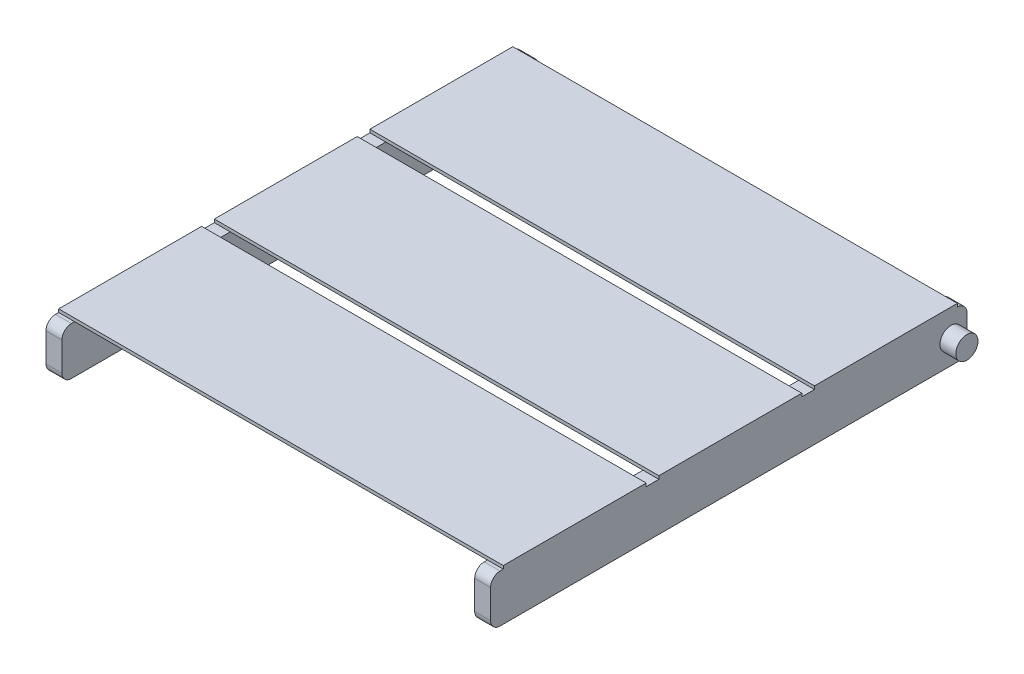
from build123d import *

# Parameters (mm, degrees)
BOSS_EXTRUDE1_DEPTH = 50
SKETCH2_W           = 1400
SKETCH2_H           = 450
BOSS_EXTRUDE2_DEPTH = 10
LPATTERN1_COUNT     = 2
LPATTERN1_PITCH     = 1350
LPATTERN2_COUNT     = 3
LPATTERN2_PITCH     = 490
SKETCH3_R           = 35
BOSS_EXTRUDE3_DEPTH = 50
LPATTERN3_COUNT     = 2
LPATTERN3_PITCH     = 1450


with BuildPart() as part:
    # Sketch1 → Boss-Extrude1 (new body)
    with BuildSketch(Plane(origin=(0, 0, 0), x_dir=(0, 0, -1), z_dir=(1, 0, 0))):
        with BuildLine():
            Line((-720, -75), (720, -75))
            ThreePointArc((720, -75), (741.213203436, -66.213203436), (750, -45))
            Line((750, -45), (750, 45))
            ThreePointArc((750, 45), (741.213203436, 66.213203436), (720, 75))
            Line((720, 75), (-720, 75))
            ThreePointArc((-720, 75), (-741.213203436, 66.213203436), (-750, 45))
            Line((-750, 45), (-750, -45))
            ThreePointArc((-750, -45), (-741.213203436, -66.213203436), (-720, -75))
        make_face()
    boss_extrude1 = extrude(amount=BOSS_EXTRUDE1_DEPTH)

    # Sketch2 → Boss-Extrude2 (add)
    with BuildSketch(Plane(origin=(0, 75, 0), x_dir=(1, 0, 0), z_dir=(0, 1, 0))):
        with Locations((700, 495)):
            Rectangle(SKETCH2_W, SKETCH2_H)
    boss_extrude2 = extrude(amount=BOSS_EXTRUDE2_DEPTH)

    # LPattern1: Boss-Extrude1 ×2
    with Locations(*[(i * LPATTERN1_PITCH, 0, 0) for i in range(1, LPATTERN1_COUNT)]):
        add(boss_extrude1)

    # LPattern2: Boss-Extrude2 ×3
    with Locations(*[(0, 0, i * LPATTERN2_PITCH) for i in range(1, LPATTERN2_COUNT)]):
        add(boss_extrude2)

    # Sketch3 → Boss-Extrude3 (add)
    with BuildSketch(Plane.ZY):
        with Locations(Location((-700, 0, 0), (0, 0, 180))):
            Circle(SKETCH3_R)
    boss_extrude3 = extrude(amount=BOSS_EXTRUDE3_DEPTH)

    # LPattern3: Boss-Extrude3 ×2
    with Locations(*[(i * LPATTERN3_PITCH, 0, 0) for i in range(1, LPATTERN3_COUNT)]):
        add(boss_extrude3)


solid = part.part
